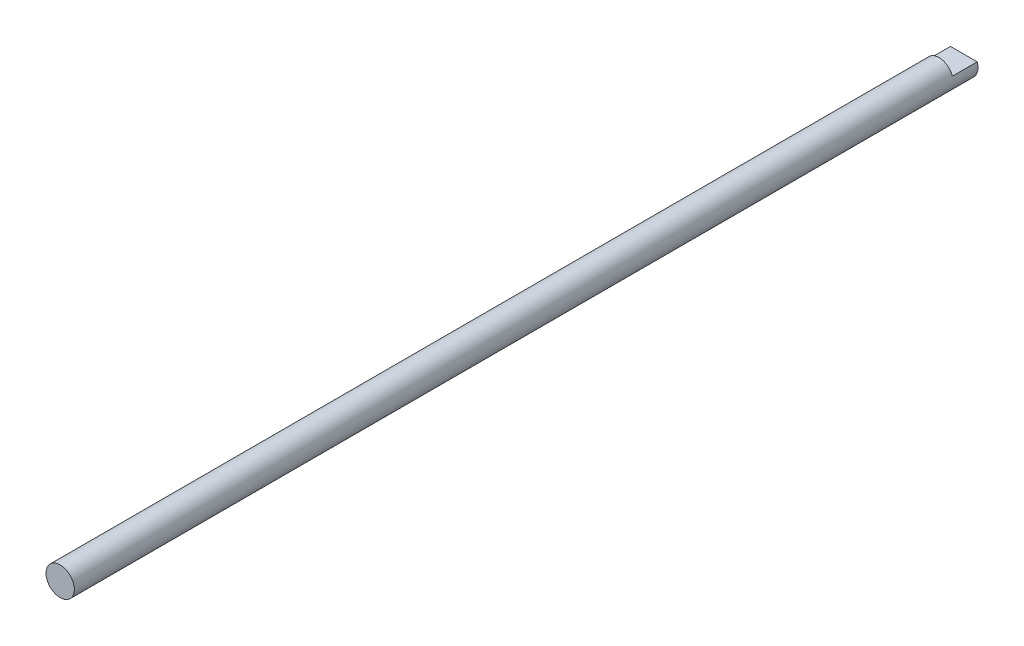
from build123d import *

# Parameters (mm, degrees)
SKETCH1_R           = 4
BOSS_EXTRUDE1_DEPTH = 255
CUT_EXTRUDE1_START  = -255
CUT_EXTRUDE1_DEPTH  = 7


with BuildPart() as part:
    # Sketch1 → Boss-Extrude1 (new body)
    with BuildSketch(Plane.XY):
        Circle(SKETCH1_R)
    extrude(amount=BOSS_EXTRUDE1_DEPTH)

    # Sketch2 → Cut-Extrude1 (cut)
    with BuildSketch(Plane.XY.offset(255).offset(CUT_EXTRUDE1_START)):
        Polygon((-3.771236166, 1.333333333), (3.771236166, 1.333333333), (7.722686655, 6.886897816), (-8.219252697, 6.886897816), align=None)
    extrude(amount=CUT_EXTRUDE1_DEPTH, mode=Mode.SUBTRACT)


solid = part.part
